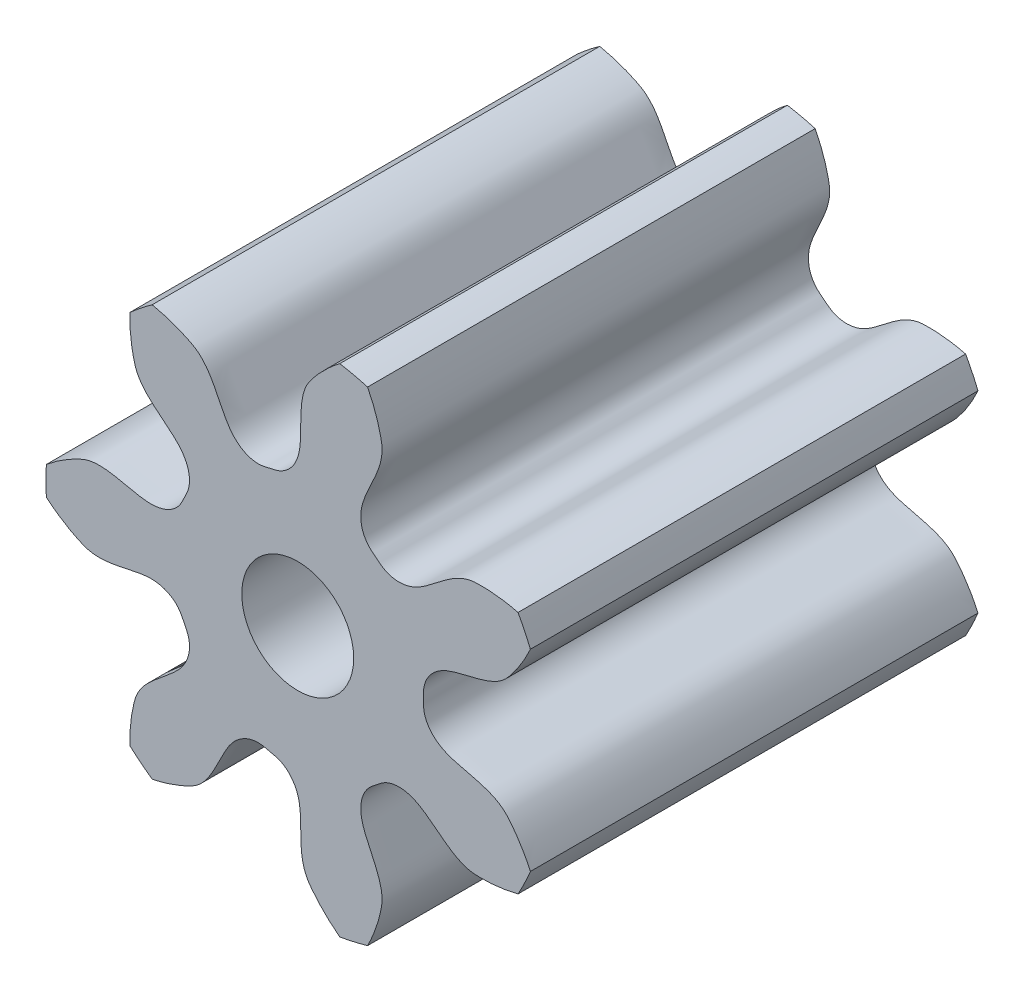
from build123d import *

# Parameters (mm, degrees)
SKETCHREVOLVESPURGEAR2_W       = 19.05
SKETCHREVOLVESPURGEAR2_H       = 2.249999966
TOOTHEXTRUDECUTSPURGEAR2_DEPTH = 9.525
PATTERNSPURGEAR2_COUNT         = 7
CUT_EXTRUDE1_START             = -15.05
SKETCH2_R                      = 2.249999966
CUT_EXTRUDE1_DEPTH             = 15.05
SKETCH3_R                      = 0.5
CUT_EXTRUDE2_DEPTH             = 15.05


with BuildPart() as part:
    # SketchRevolveSpurGear2 → SpurGear2 (revolve)
    with BuildSketch(Plane(origin=(0, 0, 0), x_dir=(0, 0, -1), z_dir=(1, 0, 0))):
        with Locations((0, 1.124999983)):
            Rectangle(SKETCHREVOLVESPURGEAR2_W, SKETCHREVOLVESPURGEAR2_H)
    revolve(axis=Axis((0, 0, 0), (0, 0, -1)))

    # SketchToothSpurGear2 → ToothExtrudeCutSpurGear2 (cut, symmetric)
    with BuildSketch(Plane.XY):
        with BuildLine():
            ThreePointArc((2.093126022, 0.891318293), (2.274999966, 0), (2.093126022, -0.891318293))
            add(Edge.make_bspline(
                [(2.093126022, -0.891318293), (2.06568264, -0.827469483), (2.02468458, -0.746848972), (1.965341144, -0.654730992), (1.931559724, -0.607223093), (1.897667053, -0.564714783), (1.757086934, -0.395906575), (1.522380232, -0.389508293), (1.348025963, -0.326429873), (1.344341478, -0.325058551), (1.340675795, -0.323659912), (1.337028867, -0.322232658), (1.333400852, -0.320777025), (1.32979186, -0.319292837), (1.326202016, -0.317780022), (1.322631448, -0.316238475), (1.319080287, -0.314668093), (1.315548671, -0.313068768), (1.31203674, -0.31144039), (1.308544642, -0.309782843), (1.305072528, -0.308096005), (1.301620557, -0.306379754), (1.298188892, -0.304633962), (1.294777704, -0.302858495), (1.291387169, -0.301053219), (1.28801747, -0.299217993), (1.284668801, -0.297352675), (1.281341358, -0.295457117), (1.278035348, -0.293531168), (1.274750988, -0.291574675), (1.2714885, -0.289587481), (1.268248117, -0.287569426), (1.265030083, -0.285520347), (1.261834649, -0.283440079), (1.258662078, -0.281328455), (1.255512643, -0.279185305), (1.252386629, -0.277010457), (1.249284332, -0.27480374), (1.246206059, -0.27256498), (1.243152132, -0.270294002), (1.240122882, -0.267990633), (1.237118656, -0.265654698), (1.234139815, -0.263286025), (1.231186731, -0.26088444), (1.228259794, -0.258449773), (1.225359406, -0.255981857), (1.222485986, -0.253480527), (1.219639968, -0.250945622), (1.216821803, -0.248376984), (1.214031955, -0.245774463), (1.211270909, -0.243137911), (1.208539165, -0.240467192), (1.20583724, -0.237762172), (1.203165668, -0.235022729), (1.200525003, -0.23224875), (1.197915815, -0.229440132), (1.195338692, -0.226596784), (1.192794242, -0.223718626), (1.19028309, -0.220805595), (1.187805878, -0.217857639), (1.185363269, -0.214874725), (1.182955942, -0.211856835), (1.180584595, -0.208803973), (1.178249944, -0.205716158), (1.17595272, -0.202593434), (1.173693675, -0.199435867), (1.171473574, -0.196243544), (1.169293199, -0.193016581), (1.16715335, -0.189755118), (1.165054837, -0.186459324), (1.162998487, -0.183129396), (1.16098514, -0.179765564), (1.159015646, -0.176368087), (1.157090868, -0.172937259), (1.155211677, -0.169473409), (1.153378952, -0.1659769), (1.15159358, -0.162448133), (1.149856453, -0.158887547), (1.148168466, -0.155295619), (1.146530517, -0.151672869), (1.144943502, -0.148019853), (1.143408318, -0.144337173), (1.141925856, -0.140625471), (1.140497003, -0.136885432), (1.139122634, -0.133117784), (1.137803619, -0.1293233), (1.136540811, -0.125502794), (1.13533505, -0.121657126), (1.134187158, -0.117787197), (1.133097939, -0.113893953), (1.132068171, -0.109978382), (1.131098611, -0.106041512), (1.130189986, -0.102084413), (1.129342997, -0.098108194), (1.128558309, -0.094114005), (1.127836556, -0.090103029), (1.127178335, -0.086076487), (1.126584203, -0.082035632), (1.126054677, -0.07798175), (1.125590233, -0.073916156), (1.1251913, -0.06984019), (1.124858264, -0.06575522), (1.124591456, -0.061662634), (1.124391186, -0.057563839), (1.124257604, -0.053460259), (1.124191227, -0.049353335), (1.124190957, -0.045244501), (1.124251989, -0.041687784), (1.12466799, -0.02660959), (1.125312184, 0), (1.12466799, 0.02660959), (1.124251989, 0.041687784), (1.124190957, 0.045244501), (1.124191227, 0.049353335), (1.124257604, 0.053460259), (1.124391186, 0.057563839), (1.124591456, 0.061662634), (1.124858264, 0.06575522), (1.1251913, 0.06984019), (1.125590233, 0.073916156), (1.126054677, 0.07798175), (1.126584203, 0.082035632), (1.127178335, 0.086076487), (1.127836556, 0.090103029), (1.128558309, 0.094114005), (1.129342997, 0.098108194), (1.130189986, 0.102084413), (1.131098611, 0.106041512), (1.132068171, 0.109978382), (1.133097939, 0.113893953), (1.134187158, 0.117787197), (1.13533505, 0.121657126), (1.136540811, 0.125502794), (1.137803619, 0.1293233), (1.139122634, 0.133117784), (1.140497003, 0.136885432), (1.141925856, 0.140625471), (1.143408318, 0.144337173), (1.144943502, 0.148019853), (1.146530517, 0.151672869), (1.148168466, 0.155295619), (1.149856453, 0.158887547), (1.15159358, 0.162448133), (1.153378952, 0.1659769), (1.155211677, 0.169473409), (1.157090868, 0.172937259), (1.159015646, 0.176368087), (1.16098514, 0.179765564), (1.162998487, 0.183129396), (1.165054837, 0.186459324), (1.16715335, 0.189755118), (1.169293199, 0.193016581), (1.171473574, 0.196243544), (1.173693675, 0.199435867), (1.17595272, 0.202593434), (1.178249944, 0.205716158), (1.180584595, 0.208803973), (1.182955942, 0.211856835), (1.185363269, 0.214874725), (1.187805878, 0.217857639), (1.19028309, 0.220805595), (1.192794242, 0.223718626), (1.195338692, 0.226596784), (1.197915815, 0.229440132), (1.200525003, 0.23224875), (1.203165668, 0.235022729), (1.20583724, 0.237762172), (1.208539165, 0.240467192), (1.211270909, 0.243137911), (1.214031955, 0.245774463), (1.216821803, 0.248376984), (1.219639968, 0.250945622), (1.222485986, 0.253480527), (1.225359406, 0.255981857), (1.228259794, 0.258449773), (1.231186731, 0.26088444), (1.234139815, 0.263286025), (1.237118656, 0.265654698), (1.240122882, 0.267990633), (1.243152132, 0.270294002), (1.246206059, 0.27256498), (1.249284332, 0.27480374), (1.252386629, 0.277010457), (1.255512643, 0.279185305), (1.258662078, 0.281328455), (1.261834649, 0.283440079), (1.265030083, 0.285520347), (1.268248117, 0.287569426), (1.2714885, 0.289587481), (1.274750988, 0.291574675), (1.278035348, 0.293531168), (1.281341358, 0.295457117), (1.284668801, 0.297352675), (1.28801747, 0.299217993), (1.291387169, 0.301053219), (1.294777704, 0.302858495), (1.298188892, 0.304633962), (1.301620557, 0.306379754), (1.305072528, 0.308096005), (1.308544642, 0.309782843), (1.31203674, 0.31144039), (1.315548671, 0.313068768), (1.319080287, 0.314668093), (1.322631448, 0.316238475), (1.326202016, 0.317780022), (1.32979186, 0.319292837), (1.333400852, 0.320777025), (1.337028867, 0.322232658), (1.340675795, 0.323659912), (1.344341478, 0.325058551), (1.348025963, 0.326429873), (1.522380232, 0.389508293), (1.757086934, 0.395906575), (1.897667053, 0.564714783), (1.931559724, 0.607223093), (1.965341144, 0.654730992), (2.02468458, 0.746848972), (2.06568264, 0.827469483), (2.093126022, 0.891318293)],
                knots=[0, 0, 0, 0, 0.073649657, 0.095549778, 0.116122619, 0.13536818, 0.153286461, 0.347092616, 0.34848416, 0.34987298, 0.351259148, 0.352642735, 0.354023814, 0.355402461, 0.356778749, 0.358152755, 0.359524557, 0.360894233, 0.362261861, 0.363627523, 0.364991298, 0.366353271, 0.367713523, 0.369072138, 0.370429203, 0.371784802, 0.373139022, 0.374491952, 0.375843679, 0.377194293, 0.378543884, 0.379892543, 0.38124036, 0.382587429, 0.383933841, 0.38527969, 0.386625071, 0.387970075, 0.389314799, 0.390659337, 0.392003785, 0.393348236, 0.394692786, 0.396037532, 0.397382566, 0.398727985, 0.400073884, 0.401420355, 0.402767493, 0.40411539, 0.40546414, 0.406813833, 0.408164559, 0.409516407, 0.410869466, 0.412223822, 0.413579559, 0.41493676, 0.416295507, 0.417655878, 0.419017949, 0.420381796, 0.42174749, 0.423115099, 0.424484689, 0.425856324, 0.427230061, 0.428605958, 0.429984066, 0.431364434, 0.432747105, 0.434132119, 0.435519512, 0.436909315, 0.438301553, 0.439696249, 0.441093417, 0.442493069, 0.443895211, 0.445299843, 0.446706958, 0.448116547, 0.449528593, 0.450943073, 0.452359958, 0.453779215, 0.455200803, 0.456624677, 0.458050785, 0.459479069, 0.460909467, 0.46234191, 0.463776323, 0.465212628, 0.46665074, 0.468090569, 0.469532021, 0.470974998, 0.472419396, 0.473865108, 0.475312024, 0.476760029, 0.478209007, 0.479658837, 0.481109398, 0.482560564, 0.484012211, 0.485464211, 0.486330764, 0.5, 0.513669236, 0.514535789, 0.515987789, 0.517439436, 0.518890602, 0.520341163, 0.521790993, 0.523239971, 0.524687976, 0.526134892, 0.527580604, 0.529025002, 0.530467979, 0.531909431, 0.53334926, 0.534787372, 0.536223677, 0.53765809, 0.539090533, 0.540520931, 0.541949215, 0.543375323, 0.544799197, 0.546220785, 0.547640042, 0.549056927, 0.550471407, 0.551883453, 0.553293042, 0.554700157, 0.556104789, 0.557506931, 0.558906583, 0.560303751, 0.561698447, 0.563090685, 0.564480488, 0.565867881, 0.567252895, 0.568635566, 0.570015934, 0.571394042, 0.572769939, 0.574143676, 0.575515311, 0.576884901, 0.57825251, 0.579618204, 0.580982051, 0.582344122, 0.583704493, 0.58506324, 0.586420441, 0.587776178, 0.589130534, 0.590483593, 0.591835441, 0.593186167, 0.59453586, 0.59588461, 0.597232507, 0.598579645, 0.599926116, 0.601272015, 0.602617434, 0.603962468, 0.605307214, 0.606651764, 0.607996215, 0.609340663, 0.610685201, 0.612029925, 0.613374929, 0.61472031, 0.616066159, 0.617412571, 0.61875964, 0.620107457, 0.621456116, 0.622805707, 0.624156321, 0.625508048, 0.626860978, 0.628215198, 0.629570797, 0.630927862, 0.632286477, 0.633646729, 0.635008702, 0.636372477, 0.637738139, 0.639105767, 0.640475443, 0.641847245, 0.643221251, 0.644597539, 0.645976186, 0.647357265, 0.648740852, 0.65012702, 0.65151584, 0.652907384, 0.846713539, 0.86463182, 0.883877381, 0.904450222, 0.926350343, 1, 1, 1, 1], degree=3))
        make_face()
    toothextrudecutspurgear2 = extrude(amount=TOOTHEXTRUDECUTSPURGEAR2_DEPTH, both=True, mode=Mode.SUBTRACT)

    # PatternSpurGear2: ToothExtrudeCutSpurGear2 ×7 about axis
    patternspurgear2_axis = Axis((0, 0, 55), (0, 0, -1))
    for i in range(1, PATTERNSPURGEAR2_COUNT):
        add(toothextrudecutspurgear2.rotate(patternspurgear2_axis, i * 360 / PATTERNSPURGEAR2_COUNT), mode=Mode.SUBTRACT)

    # Sketch2 → Cut-Extrude1 (cut)
    with BuildSketch(Plane.XY.offset(9.525).offset(CUT_EXTRUDE1_START)):
        Circle(SKETCH2_R)
    extrude(amount=CUT_EXTRUDE1_DEPTH, mode=Mode.SUBTRACT)

    # Sketch3 → Cut-Extrude2 (cut)
    with BuildSketch(Plane.XY.offset(-5.525)):
        Circle(SKETCH3_R)
    extrude(amount=-CUT_EXTRUDE2_DEPTH, mode=Mode.SUBTRACT)


solid = part.part
